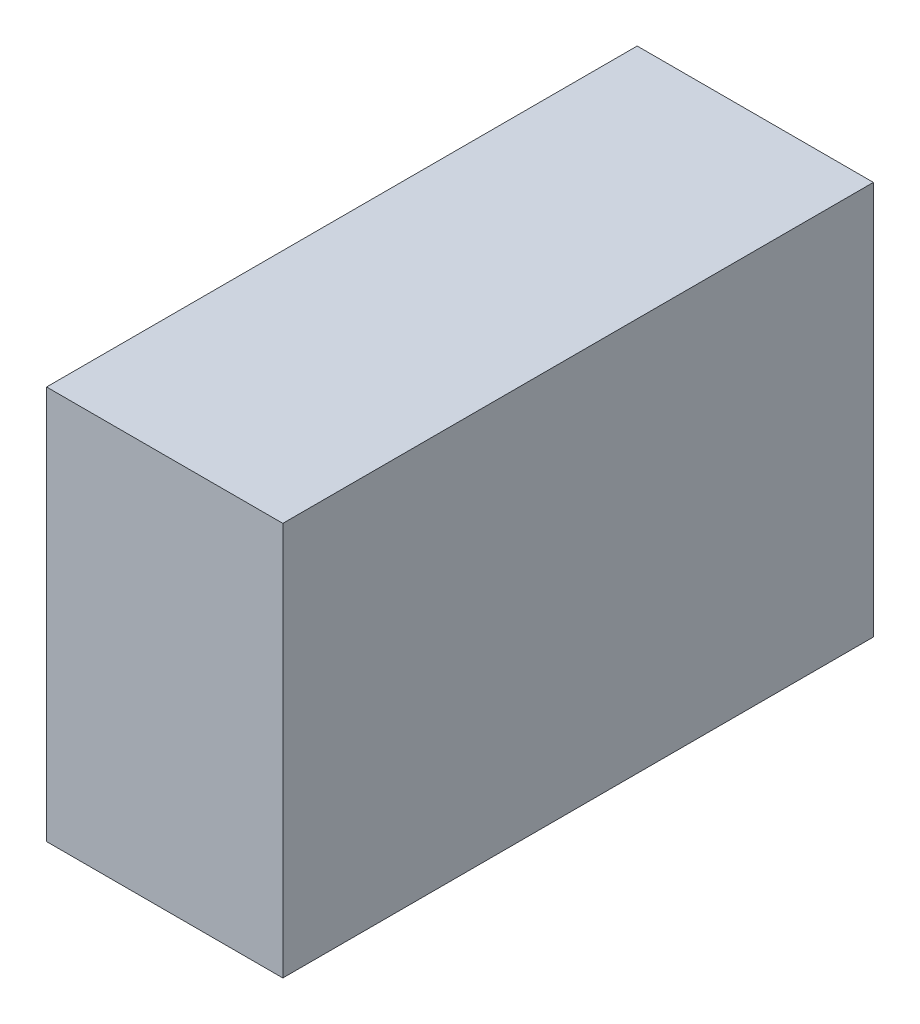
from build123d import *

# Parameters (mm, degrees)
SKETCH1_W           = 12
SKETCH1_H           = 30
BOSS_EXTRUDE1_DEPTH = 20


with BuildPart() as part:
    # Sketch1 → Boss-Extrude1 (new body)
    with BuildSketch(Plane(origin=(0, 0, 0), x_dir=(1, 0, 0), z_dir=(0, 1, 0))):
        Rectangle(SKETCH1_W, SKETCH1_H)
    extrude(amount=BOSS_EXTRUDE1_DEPTH)


solid = part.part
